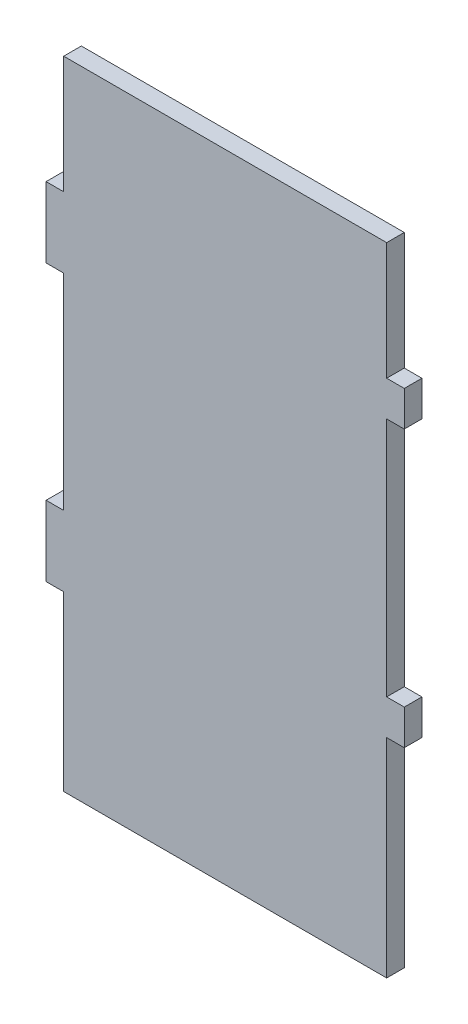
from build123d import *

# Parameters (mm, degrees)
P_IDAT_VYSUNUT_M1_DEPTH = 3


with BuildPart() as part:
    # Skica1 → Přidat vysunutím1 (new body)
    with BuildSketch(Plane.XY):
        Polygon((0, 0), (55, 0), (55, -20), (58, -20), (58, -26), (55, -26), (55, -67), (58, -67), (58, -73), (55, -73), (55, -108.46), (0, -108.46), (0, -79), (-3, -79), (-3, -67), (0, -67), (0, -32), (-3, -32), (-3, -20), (0, -20), align=None)
    extrude(amount=P_IDAT_VYSUNUT_M1_DEPTH)


solid = part.part
